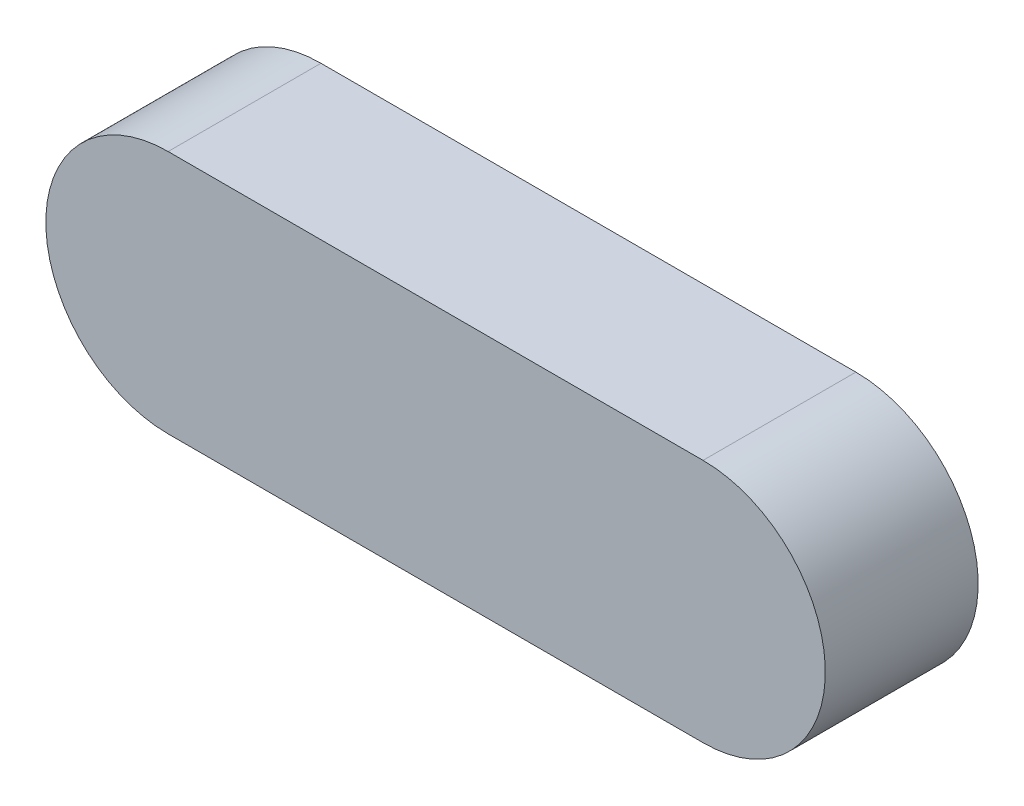
from build123d import *

# Parameters (mm, degrees)
EXTRUDE_1_DEPTH = 20


with BuildPart() as part:
    # 草图1 → 拉伸1 (new body)
    with BuildSketch(Plane.XY):
        with BuildLine():
            Line((-35, 16), (35, 16))
            ThreePointArc((35, 16), (51, 0), (35, -16))
            Line((35, -16), (-35, -16))
            ThreePointArc((-35, -16), (-51, 0), (-35, 16))
        make_face()
    extrude(amount=EXTRUDE_1_DEPTH)


solid = part.part
